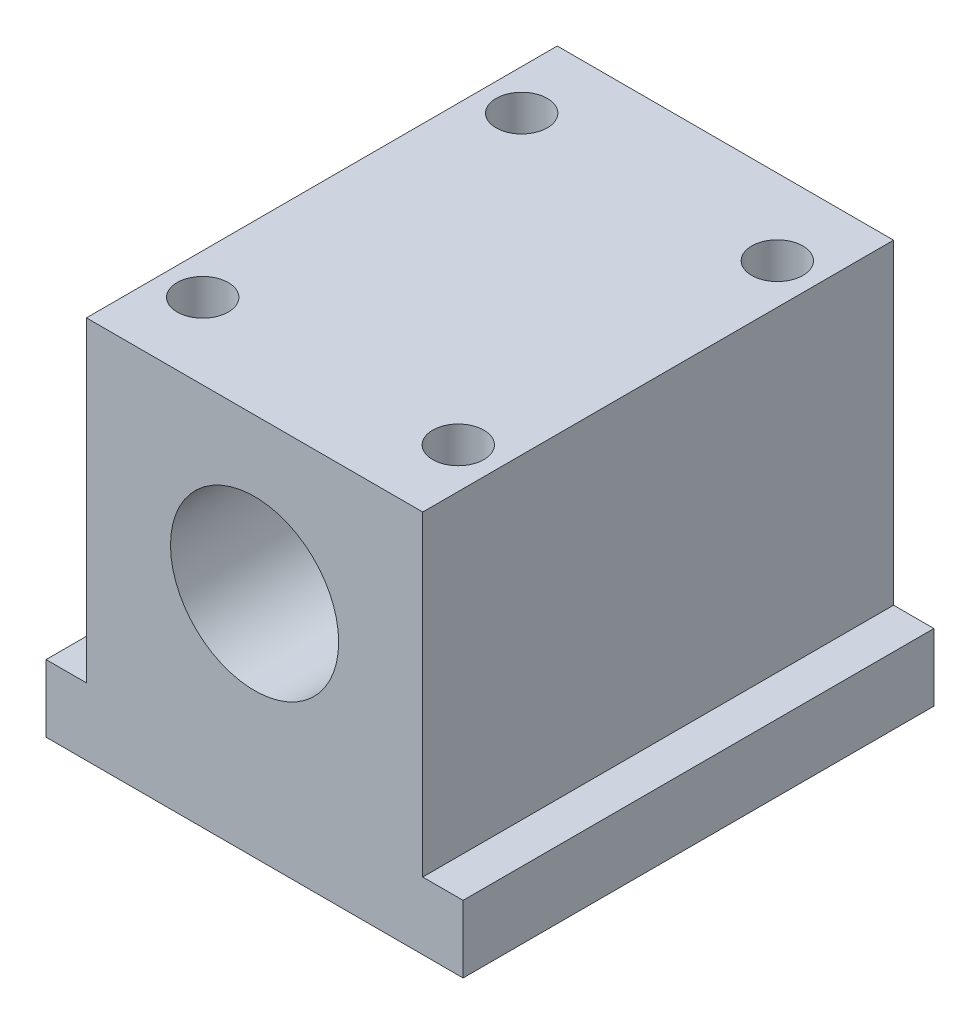
from build123d import *

# Parameters (mm, degrees)
SKETCH1_R           = 12.5
BOSS_EXTRUDE1_DEPTH = 70
SKETCH2_R           = 3.805013563
CUT_EXTRUDE1_DEPTH  = 23
SKETCH3_R           = 3.805013563
CUT_EXTRUDE2_DEPTH  = 12


with BuildPart() as part:
    # Sketch1 → Boss-Extrude1 (new body)
    with BuildSketch(Plane.XY):
        Polygon((25, -19.03462444), (31, -19.03462444), (31, -29.03462444), (-31, -29.03462444), (-31, -19.03462444), (-25, -19.03462444), (-25, 27.96537556), (25, 27.96537556), align=None)
        with Locations((0, 4.96537556)):
            Circle(SKETCH1_R, mode=Mode.SUBTRACT)
    extrude(amount=BOSS_EXTRUDE1_DEPTH)

    # Sketch2 → Cut-Extrude1 (cut)
    with BuildSketch(Plane(origin=(0, 27.96537556, 0), x_dir=(1, 0, 0), z_dir=(0, 1, 0))):
        with Locations(Location((19, -58.714630835, 0), (0, 0, 180))):
            Circle(SKETCH2_R)
        with Locations((-19, -58.714630835)):
            Circle(SKETCH2_R)
    extrude(amount=-CUT_EXTRUDE1_DEPTH, mode=Mode.SUBTRACT)

    # Sketch3 → Cut-Extrude2 (cut)
    with BuildSketch(Plane(origin=(0, 27.96537556, 0), x_dir=(1, 0, 0), z_dir=(0, 1, 0))):
        with Locations((19, -11.285369165)):
            Circle(SKETCH3_R)
        with Locations(Location((-19, -11.285369165, 0), (0, 0, 180))):
            Circle(SKETCH3_R)
    extrude(amount=-CUT_EXTRUDE2_DEPTH, mode=Mode.SUBTRACT)


solid = part.part
